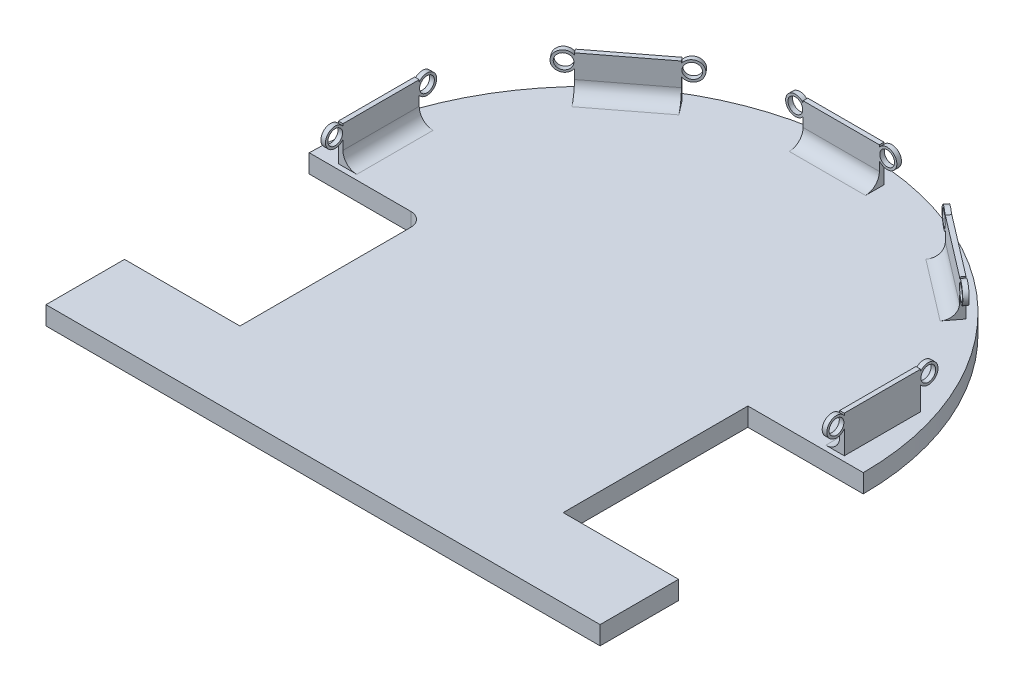
from build123d import *

# Parameters (mm, degrees)
BOSS_EXTRUDE1_DEPTH  = 4
FILLET1_R            = 3
SKETCH3_W            = 1
SKETCH3_H            = 16.52
BOSS_EXTRUDE2_DEPTH  = 8
SKETCH4_R            = 2.1
BOSS_EXTRUDE3_DEPTH  = 1
SKETCH5_R            = 1.6
CUT_EXTRUDE1_DEPTH   = 1
SKETCH6_R            = 2.1
BOSS_EXTRUDE4_DEPTH  = 1
SKETCH7_R            = 1.6
CUT_EXTRUDE2_DEPTH   = 1
FILLET2_R            = 3
SKETCH8_W            = 1
SKETCH8_H            = 16.52
BOSS_EXTRUDE5_DEPTH  = 8
FILLET3_R            = 3
SKETCH9_R            = 2.1
BOSS_EXTRUDE6_DEPTH  = 1
SKETCH10_R           = 2.1
BOSS_EXTRUDE7_DEPTH  = 1
SKETCH11_R           = 1.6
CUT_EXTRUDE3_DEPTH   = 1
SKETCH13_W           = 16.52
SKETCH13_H           = 1
BOSS_EXTRUDE8_DEPTH  = 8
BOSS_EXTRUDE9_DEPTH  = 8
BOSS_EXTRUDE10_DEPTH = 8
SKETCH16_R           = 2.1
BOSS_EXTRUDE11_DEPTH = 1
SKETCH17_R           = 2.1
BOSS_EXTRUDE12_DEPTH = 1
SKETCH18_R           = 1.6
CUT_EXTRUDE4_DEPTH   = 1
SKETCH19_R           = 1.6
CUT_EXTRUDE5_DEPTH   = 1
SKETCH20_R           = 2.1
BOSS_EXTRUDE13_DEPTH = 1
SKETCH21_R           = 2.1
BOSS_EXTRUDE14_DEPTH = 1
SKETCH22_R           = 1.6
CUT_EXTRUDE6_DEPTH   = 1
SKETCH23_R           = 2.1
BOSS_EXTRUDE15_DEPTH = 1
SKETCH24_R           = 2.1
BOSS_EXTRUDE16_DEPTH = 1
SKETCH25_R           = 1.6
CUT_EXTRUDE7_DEPTH   = 1
FILLET4_R            = 3


with BuildPart() as part:
    # Sketch2 → Boss-Extrude1 (new body)
    with BuildSketch(Plane(origin=(0, 0, 0), x_dir=(1, 0, 0), z_dir=(0, 1, 0))):
        with BuildLine():
            Line((0, 0), (0, -17))
            Line((0, -17), (120, -17))
            Line((120, -17), (120, 0))
            Line((120, 0), (95, 0))
            Line((95, 0), (95, 40))
            Line((95, 40), (120, 40))
            ThreePointArc((120, 40), (60, 100), (0, 40))
            Line((0, 40), (25, 40))
            Line((25, 40), (25, 0))
            Line((25, 0), (0, 0))
        make_face()
    extrude(amount=-BOSS_EXTRUDE1_DEPTH)

    # Fillet1
    fillet1_edges = [part.edges().sort_by_distance(p)[0] for p in [
        (25, -2, -40),
    ]]
    fillet(fillet1_edges, radius=FILLET1_R)

    # Sketch3 → Boss-Extrude2 (add)
    with BuildSketch(Plane(origin=(0, 0, 0), x_dir=(1, 0, 0), z_dir=(0, 1, 0))):
        with Locations((5.712890466, 49.353267214)):
            Rectangle(SKETCH3_W, SKETCH3_H)
    extrude(amount=BOSS_EXTRUDE2_DEPTH)

    # Sketch4 → Boss-Extrude3 (add)
    with BuildSketch(Plane.ZY.offset(-5.212890466)):
        with Locations((-59.293267214, 6.3)):
            Circle(SKETCH4_R)
    extrude(amount=-BOSS_EXTRUDE3_DEPTH)

    # Sketch5 → Cut-Extrude1 (cut)
    with BuildSketch(Plane.ZY.offset(-5.212890466)):
        with Locations((-59.293267214, 6.3)):
            Circle(SKETCH5_R)
    extrude(amount=-CUT_EXTRUDE1_DEPTH, mode=Mode.SUBTRACT)

    # Sketch6 → Boss-Extrude4 (add)
    with BuildSketch(Plane.ZY.offset(-5.212890466)):
        with Locations((-39.413267214, 6.3)):
            Circle(SKETCH6_R)
    extrude(amount=-BOSS_EXTRUDE4_DEPTH)

    # Sketch7 → Cut-Extrude2 (cut)
    with BuildSketch(Plane.ZY.offset(-5.212890466)):
        with Locations((-39.413267214, 6.3)):
            Circle(SKETCH7_R)
    extrude(amount=-CUT_EXTRUDE2_DEPTH, mode=Mode.SUBTRACT)

    # Fillet2
    fillet2_edges = [part.edges().sort_by_distance(p)[0] for p in [
        (6.212890466, 0, -49.353267214),
    ]]
    fillet(fillet2_edges, radius=FILLET2_R)

    # Sketch8 → Boss-Extrude5 (add)
    with BuildSketch(Plane(origin=(0, 0, 0), x_dir=(1, 0, 0), z_dir=(0, 1, 0))):
        with Locations((114.29, 49.35)):
            Rectangle(SKETCH8_W, SKETCH8_H)
    extrude(amount=BOSS_EXTRUDE5_DEPTH)

    # Fillet3
    fillet3_edges = [part.edges().sort_by_distance(p)[0] for p in [
        (113.79, 0, -49.35),
    ]]
    fillet(fillet3_edges, radius=FILLET3_R)

    # Sketch9 → Boss-Extrude6 (add)
    with BuildSketch(Plane(origin=(114.79, 0, 0), x_dir=(0, 0, -1), z_dir=(1, 0, 0))):
        with Locations((39.41, 6.3)):
            Circle(SKETCH9_R)
    extrude(amount=-BOSS_EXTRUDE6_DEPTH)

    # Sketch10 → Boss-Extrude7 (add)
    with BuildSketch(Plane(origin=(114.79, 0, 0), x_dir=(0, 0, -1), z_dir=(1, 0, 0))):
        with Locations((59.29, 6.3)):
            Circle(SKETCH10_R)
    extrude(amount=-BOSS_EXTRUDE7_DEPTH)

    # Sketch11 → Cut-Extrude3 (cut)
    with BuildSketch(Plane(origin=(114.79, 0, 0), x_dir=(0, 0, -1), z_dir=(1, 0, 0))):
        with Locations((39.41, 6.3)):
            Circle(SKETCH11_R)
        with Locations((59.29, 6.3)):
            Circle(SKETCH11_R)
    extrude(amount=-CUT_EXTRUDE3_DEPTH, mode=Mode.SUBTRACT)

    # Sketch13 → Boss-Extrude8 (add)
    with BuildSketch(Plane(origin=(0, 0, 0), x_dir=(1, 0, 0), z_dir=(0, 1, 0))):
        with Locations((60, 95.723174162)):
            Rectangle(SKETCH13_W, SKETCH13_H)
    extrude(amount=BOSS_EXTRUDE8_DEPTH)

    # Sketch14 → Boss-Extrude9 (add)
    with BuildSketch(Plane(origin=(0, 0, 0), x_dir=(1, 0, 0), z_dir=(0, 1, 0))):
        Polygon((102.309314854, 79.933135701), (89.191434032, 89.974629751), (88.583595409, 89.180569168), (101.701476231, 79.139075118), align=None)
    extrude(amount=BOSS_EXTRUDE9_DEPTH)

    # Sketch15 → Boss-Extrude10 (add)
    with BuildSketch(Plane(origin=(0, 0, 0), x_dir=(1, 0, 0), z_dir=(0, 1, 0))):
        Polygon((30.495980982, 90.292754217), (17.38126662, 80.247124958), (17.989355558, 79.45325605), (31.104069921, 89.498885309), align=None)
    extrude(amount=BOSS_EXTRUDE10_DEPTH)

    # Sketch16 → Boss-Extrude11 (add)
    with BuildSketch(Plane(origin=(0, 0, -96.223174162), x_dir=(-1, 0, 0), z_dir=(0, 0, -1))):
        with Locations((-69.94, 6.3)):
            Circle(SKETCH16_R)
    extrude(amount=-BOSS_EXTRUDE11_DEPTH)

    # Sketch17 → Boss-Extrude12 (add)
    with BuildSketch(Plane(origin=(0, 0, -96.223174162), x_dir=(-1, 0, 0), z_dir=(0, 0, -1))):
        with Locations((-50.06, 6.3)):
            Circle(SKETCH17_R)
    extrude(amount=-BOSS_EXTRUDE12_DEPTH)

    # Sketch18 → Cut-Extrude4 (cut)
    with BuildSketch(Plane(origin=(0, 0, -96.223174162), x_dir=(-1, 0, 0), z_dir=(0, 0, -1))):
        with Locations((-69.94, 6.3)):
            Circle(SKETCH18_R)
    extrude(amount=-CUT_EXTRUDE4_DEPTH, mode=Mode.SUBTRACT)

    # Sketch19 → Cut-Extrude5 (cut)
    with BuildSketch(Plane(origin=(0, 0, -96.223174162), x_dir=(-1, 0, 0), z_dir=(0, 0, -1))):
        with Locations((-50.06, 6.3)):
            Circle(SKETCH19_R)
    extrude(amount=-CUT_EXTRUDE5_DEPTH, mode=Mode.SUBTRACT)

    # Sketch20 → Boss-Extrude13 (add)
    with BuildSketch(Plane(origin=(76.380579105, 0, -99.781101182), x_dir=(-0.7940605824226628, 0, -0.607838622861843), z_dir=(0.6078386228618429, 0, -0.7940605824226626))):
        with Locations((-34.333347015, 6.3)):
            Circle(SKETCH20_R)
    extrude(amount=-BOSS_EXTRUDE13_DEPTH)

    # Sketch21 → Boss-Extrude14 (add)
    with BuildSketch(Plane(origin=(76.380579105, 0, -99.781101182), x_dir=(-0.7940605824226628, 0, -0.607838622861843), z_dir=(0.6078386228618429, 0, -0.7940605824226626))):
        with Locations((-14.453347015, 6.3)):
            Circle(SKETCH21_R)
    extrude(amount=-BOSS_EXTRUDE14_DEPTH)

    # Sketch22 → Cut-Extrude6 (cut)
    with BuildSketch(Plane(origin=(76.380579105, 0, -99.781101182), x_dir=(-0.7940605824226628, 0, -0.607838622861843), z_dir=(0.6078386228618429, 0, -0.7940605824226626))):
        with Locations((-34.333347015, 6.3)):
            Circle(SKETCH22_R)
        with Locations((-14.453347015, 6.3)):
            Circle(SKETCH22_R)
    extrude(amount=-CUT_EXTRUDE6_DEPTH, mode=Mode.SUBTRACT)

    # Sketch23 → Boss-Extrude15 (add)
    with BuildSketch(Plane(origin=(-32.311621485, 0, -42.183289414), x_dir=(-0.7938689081223455, 0, 0.6080889381633537), z_dir=(-0.6080889381633537, 0, -0.7938689081223455))):
        with Locations((-80.79583616, 6.3)):
            Circle(SKETCH23_R)
    extrude(amount=-BOSS_EXTRUDE15_DEPTH)

    # Sketch24 → Boss-Extrude16 (add)
    with BuildSketch(Plane(origin=(-32.311621485, 0, -42.183289414), x_dir=(-0.7938689081223455, 0, 0.6080889381633537), z_dir=(-0.6080889381633537, 0, -0.7938689081223455))):
        with Locations((-60.91583616, 6.3)):
            Circle(SKETCH24_R)
    extrude(amount=-BOSS_EXTRUDE16_DEPTH)

    # Sketch25 → Cut-Extrude7 (cut)
    with BuildSketch(Plane(origin=(-32.311621485, 0, -42.183289414), x_dir=(-0.7938689081223455, 0, 0.6080889381633537), z_dir=(-0.6080889381633537, 0, -0.7938689081223455))):
        with Locations((-80.79583616, 6.3)):
            Circle(SKETCH25_R)
        with Locations((-60.91583616, 6.255190771)):
            Circle(SKETCH25_R)
    extrude(amount=-CUT_EXTRUDE7_DEPTH, mode=Mode.SUBTRACT)

    # Fillet4
    fillet4_edges = [part.edges().sort_by_distance(p)[0] for p in [
        (60, 0, -95.223174162),
        (95.14253582, 0, -84.159822143),
        (24.54671274, 0, -84.47607068),
    ]]
    fillet(fillet4_edges, radius=FILLET4_R)


solid = part.part
